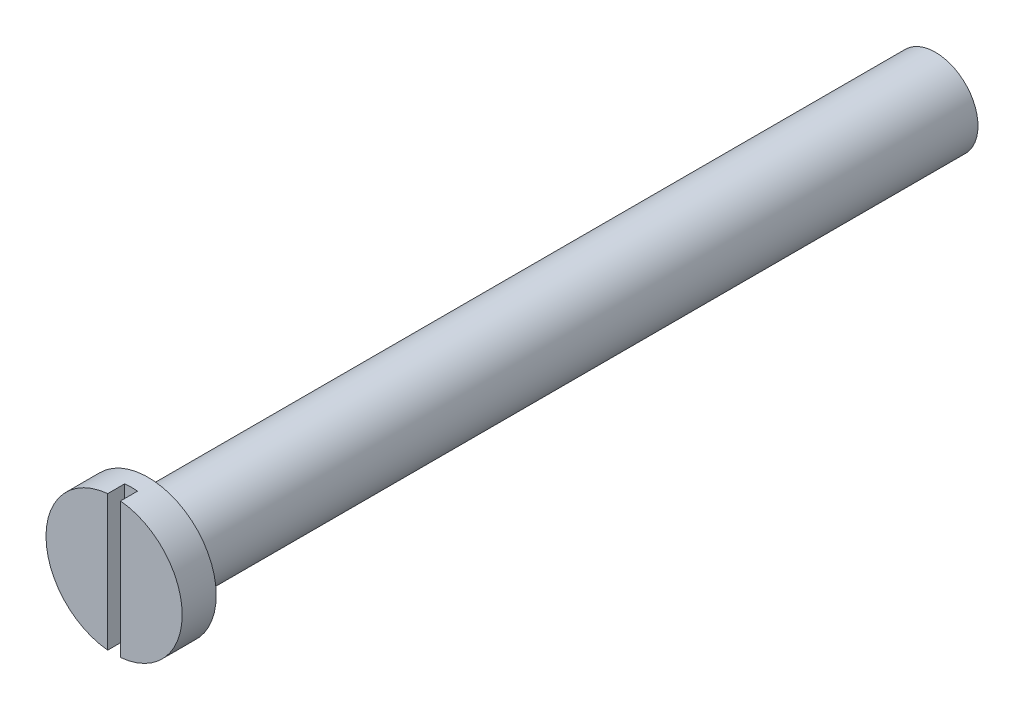
from build123d import *

# Parameters (mm, degrees)
SKETCH_1_R             = 5
EXTRUDE_1_DEPTH        = 92.5
SKETCH_2_R             = 8
EXTRUDE_2_DEPTH        = 4
SKETCH_4_W             = 1.5
SKETCH_4_H             = 19.56005024
CUT_EXTRUDE_1_DEPTH    = 2
HOLE_WIZARD_M8_1_D     = 6.8
HOLE_WIZARD_M8_1_DEPTH = 15
HOLE_WIZARD_M8_1_TIP   = 2.042926105


with BuildPart() as part:
    # 草图1 → 凸台-拉伸1 (new body)
    with BuildSketch(Plane.XY):
        Circle(SKETCH_1_R)
    extrude(amount=EXTRUDE_1_DEPTH)

    # 草图2 → 凸台-拉伸2 (add)
    with BuildSketch(Plane.XY.offset(92.5)):
        Circle(SKETCH_2_R)
    extrude(amount=EXTRUDE_2_DEPTH)

    # 草图4 → 切除-拉伸1 (cut)
    with BuildSketch(Plane.XY.offset(96.5)):
        Rectangle(SKETCH_4_W, SKETCH_4_H)
    extrude(amount=-CUT_EXTRUDE_1_DEPTH, mode=Mode.SUBTRACT)

    # M8 螺纹孔的螺纹孔钻头1
    with Locations(Plane(origin=(0, 0, 0), x_dir=(-1, 0, 0), z_dir=(0, 0, -1))):
        with Locations((0, 0)):
            Hole(HOLE_WIZARD_M8_1_D / 2, depth=HOLE_WIZARD_M8_1_DEPTH)
            with Locations((0, 0, -(HOLE_WIZARD_M8_1_DEPTH + HOLE_WIZARD_M8_1_TIP / 2))):  # 118° drill point
                Cone(0, HOLE_WIZARD_M8_1_D / 2, HOLE_WIZARD_M8_1_TIP, mode=Mode.SUBTRACT)


solid = part.part
